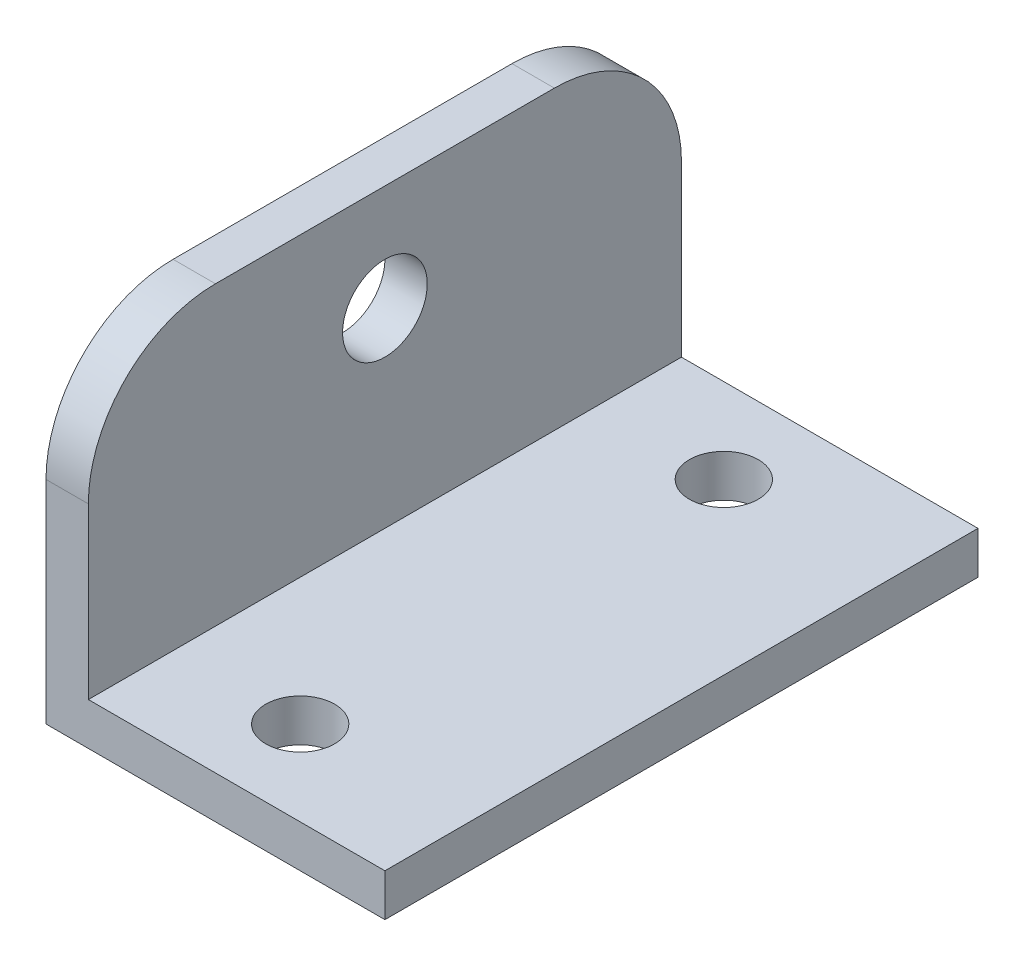
from build123d import *

# Parameters (mm, degrees)
BOSS_EXTRUDE1_DEPTH              = 44.45
F_1_4_0_25_DIAMETER_HOLE2_D      = 6.35
FILLET1_R                        = 9.525
F_13_64_0_20313_DIAMETER_HOLE1_D = 5.159375


with BuildPart() as part:
    # Sketch1 → Boss-Extrude1 (new body)
    with BuildSketch(Plane.XY):
        Polygon((0, 0), (0, 25.4), (3.175, 25.4), (3.175, 3.175), (25.4, 3.175), (25.4, 0), align=None)
    extrude(amount=BOSS_EXTRUDE1_DEPTH)

    # 1/4 (0.25) Diameter Hole2 (through all)
    with Locations(Plane.ZY):
        with Locations((22.225, 17.4625)):
            Hole(F_1_4_0_25_DIAMETER_HOLE2_D / 2)

    # Fillet1
    fillet1_edges = [part.edges().sort_by_distance(p)[0] for p in [
        (1.5875, 25.4, 44.45),
        (1.5875, 25.4, 0),
    ]]
    fillet(fillet1_edges, radius=FILLET1_R)

    # 13/64 (0.20313) Diameter Hole1 (through all)
    with Locations(Plane(origin=(0, 0, 0), x_dir=(-1, 0, 0), z_dir=(0, -1, 0))):
        with Locations((-12.7, -38.1), (-12.7, -6.35)):
            Hole(F_13_64_0_20313_DIAMETER_HOLE1_D / 2)


solid = part.part
